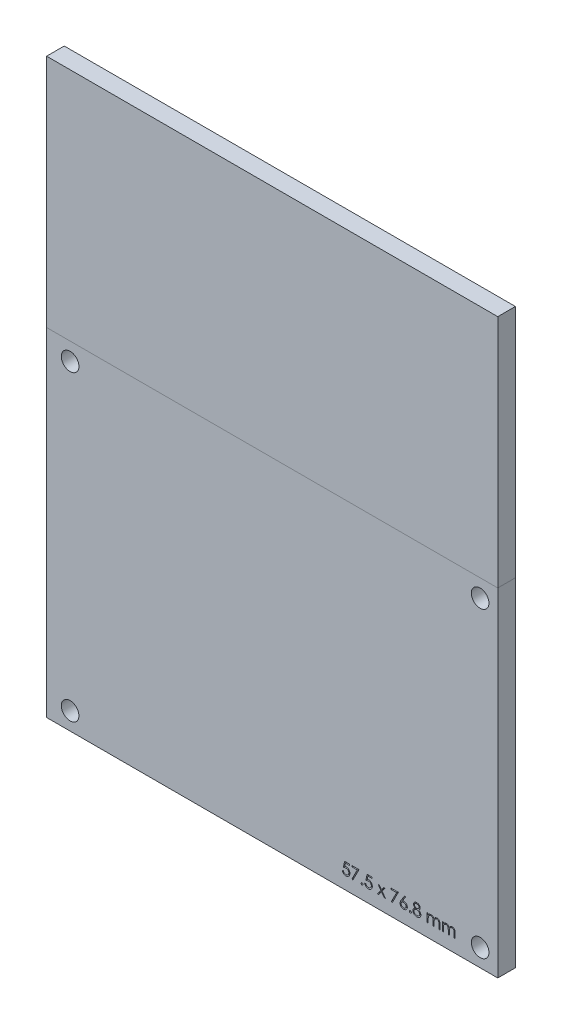
from build123d import *

# Parameters (mm, degrees)
SKETCH1_W               = 76.8
SKETCH1_H               = 57.5
BOSS_EXTRUDE1_DEPTH     = 3
CUT_EXTRUDE1_DEPTH      = 49.063733729
CUT_EXTRUDE1_DEPTH_BACK = 49.063733729
SKETCH2_R               = 1.5
CUT_EXTRUDE2_DEPTH      = 1
SKETCH5_W               = 76.8
SKETCH5_H               = 3
BOSS_EXTRUDE2_DEPTH     = 40


with BuildPart() as part:
    # Sketch1 → Boss-Extrude1 (new body)
    with BuildSketch(Plane.XY):
        Rectangle(SKETCH1_W, SKETCH1_H)
    extrude(amount=BOSS_EXTRUDE1_DEPTH)

    # Sketch2 → Cut-Extrude1 (cut, two sides: drawn at the far end of the back side and taken through both)
    with BuildSketch(Plane.XY.offset(3).offset(-CUT_EXTRUDE1_DEPTH_BACK)):
        with Locations((-34.4, 25.75)):
            Circle(SKETCH2_R)
        with Locations((-34.4, -25.75)):
            Circle(SKETCH2_R)
        with Locations((35.4, 25.75)):
            Circle(SKETCH2_R)
        with Locations((35.4, -25.75)):
            Circle(SKETCH2_R)
    extrude(amount=CUT_EXTRUDE1_DEPTH + CUT_EXTRUDE1_DEPTH_BACK, mode=Mode.SUBTRACT)

    # Sketch4 → Cut-Extrude2 (cut)
    # profile 1 of 11: a face of its own
    with BuildSketch(Plane.XY.offset(3)):
        with BuildLine():
            Line((13.150995229, -24.575900755), (13.150995229, -24.78102896))
            Line((13.150995229, -24.78102896), (12.470706767, -24.78102896))
            Line((12.470706767, -24.78102896), (12.362934332, -25.307070627))
            add(Edge.make_bspline(
                [(12.362934332, -25.307070627), (12.384109117, -25.301224757), (12.425131915, -25.289899309), (12.485680407, -25.277324583), (12.543161666, -25.26974433), (12.580461877, -25.268709295), (12.598511255, -25.268208447)],
                knots=[0, 0, 0, 0, 1.100273476, 2.13160584, 3.095893838, 4, 4, 4, 4], degree=3))
            add(Edge.make_bspline(
                [(12.598511255, -25.268208447), (12.62084482, -25.268691839), (12.66475819, -25.269642308), (12.729009017, -25.278769079), (12.790342099, -25.293134745), (12.848629167, -25.313203614), (12.903978054, -25.338866319), (12.955879517, -25.370923428), (13.00511261, -25.408371046), (13.050794093, -25.451425338), (13.092236554, -25.498809119), (13.128674263, -25.549756474), (13.159624314, -25.603772281), (13.184516174, -25.661372629), (13.204392937, -25.721920717), (13.217622648, -25.786053621), (13.226432196, -25.853166832), (13.227416417, -25.899055158), (13.227918306, -25.922455242)],
                knots=[0, 0, 0, 0, 1.052922333, 2.070308379, 3.05430497, 4.020497103, 4.973039431, 5.925935799, 6.892292201, 7.88610001, 8.88166317, 9.857072816, 10.836096531, 11.812156883, 12.81219415, 13.836441305, 14.89672472, 16, 16, 16, 16], degree=3))
            add(Edge.make_bspline(
                [(13.227918306, -25.922455242), (13.227538263, -25.938753654), (13.226783313, -25.971130218), (13.22294412, -26.019212619), (13.215552282, -26.066277095), (13.205627868, -26.11232989), (13.192746487, -26.157283817), (13.177152742, -26.201267547), (13.158069297, -26.244007322), (13.137137083, -26.285907548), (13.113567667, -26.326020981), (13.08740852, -26.363534687), (13.059771096, -26.39901142), (13.030033162, -26.432070696), (12.997918307, -26.462495277), (12.963815469, -26.490465724), (12.927996773, -26.516455056), (12.889908063, -26.53940831), (12.850398072, -26.560529999), (12.808896234, -26.577857735), (12.766347262, -26.593349465), (12.722138762, -26.605697767), (12.676370869, -26.615373512), (12.62896814, -26.621945284), (12.580179186, -26.62673182), (12.54710775, -26.627031452), (12.53040228, -26.627182806)],
                knots=[0, 0, 0, 0, 1.056347294, 2.098418968, 3.122841568, 4.141288669, 5.149314143, 6.15115421, 7.162517403, 8.180376062, 9.185164535, 10.17417709, 11.141909838, 12.097768115, 13.052685741, 14.0056014, 14.954263652, 15.917497458, 16.885230207, 17.854509472, 18.828990115, 19.81800267, 20.826176721, 21.857883937, 22.917946725, 24, 24, 24, 24], degree=3))
            add(Edge.make_bspline(
                [(12.53040228, -26.627182806), (12.510474177, -26.626788042), (12.471267988, -26.626011389), (12.413827664, -26.61788654), (12.358562175, -26.606250017), (12.305916403, -26.588743577), (12.255418538, -26.56680798), (12.207748414, -26.539084453), (12.16168797, -26.507667823), (12.119109663, -26.470593335), (12.079591884, -26.430070088), (12.044216736, -26.386094293), (12.012711835, -26.339391755), (11.985581694, -26.289735667), (11.962439968, -26.237256506), (11.944259974, -26.181757649), (11.929586629, -26.123529075), (11.92337896, -26.083441355), (11.920225998, -26.063080242)],
                knots=[0, 0, 0, 0, 1.0467383, 2.05933395, 3.04377827, 4.011590433, 4.970194871, 5.932262533, 6.905835911, 7.896367577, 8.894135286, 9.877477877, 10.858688626, 11.851381753, 12.8477658, 13.868841284, 14.917554742, 16, 16, 16, 16], degree=3))
            Line((11.920225998, -26.063080242), (12.099713178, -26.063080242))
            add(Edge.make_bspline(
                [(12.099713178, -26.063080242), (12.104129496, -26.082152501), (12.112617906, -26.118810441), (12.131249762, -26.170314064), (12.154030262, -26.216210764), (12.181118461, -26.257107668), (12.213432765, -26.292769952), (12.250306724, -26.324551131), (12.29164828, -26.353222633), (12.337587268, -26.377121357), (12.386051885, -26.397503502), (12.436776005, -26.411075899), (12.488378489, -26.420619267), (12.523280415, -26.421574558), (12.540818947, -26.422054601)],
                knots=[0, 0, 0, 0, 1.136247022, 2.183929868, 3.172523383, 4.106158343, 5.02341133, 5.958108904, 6.928429099, 7.938127109, 8.96079061, 9.975095812, 10.982467395, 12, 12, 12, 12], degree=3))
            add(Edge.make_bspline(
                [(12.540818947, -26.422054601), (12.557938058, -26.421585585), (12.591645728, -26.420662089), (12.641252235, -26.413554082), (12.689145306, -26.402606898), (12.734852367, -26.386224124), (12.779173246, -26.366312857), (12.820986829, -26.340761385), (12.861502759, -26.31135566), (12.899461693, -26.277666157), (12.934227092, -26.240540617), (12.964944876, -26.200839249), (12.990531683, -26.158486766), (13.012094031, -26.114216393), (13.028467345, -26.067542931), (13.040147906, -26.018685117), (13.047006796, -25.967522271), (13.047950328, -25.932625523), (13.048431126, -25.914843063)],
                knots=[0, 0, 0, 0, 1.027316725, 2.022795036, 3.002884548, 3.971462791, 4.93288096, 5.914575861, 6.907176829, 7.935150275, 8.956128384, 9.956726525, 10.942570165, 11.921478529, 12.907843606, 13.90538589, 14.932640048, 16, 16, 16, 16], degree=3))
            add(Edge.make_bspline(
                [(13.048431126, -25.914843063), (13.048054852, -25.898799776), (13.04731835, -25.867397325), (13.041300881, -25.821454922), (13.03083404, -25.777984612), (13.016306108, -25.736776478), (12.997860675, -25.697791654), (12.975319925, -25.660989905), (12.948260841, -25.626856286), (12.91735119, -25.595374827), (12.883489452, -25.566320613), (12.846093028, -25.541552563), (12.805944499, -25.520716039), (12.763527585, -25.502734326), (12.717833357, -25.489819614), (12.66976671, -25.480123679), (12.618808591, -25.474514901), (12.583968198, -25.473736679), (12.566059332, -25.473336652)],
                knots=[0, 0, 0, 0, 1.045622112, 2.046656509, 3.013763289, 3.955457236, 4.890082067, 5.820317437, 6.762574623, 7.722996705, 8.69280354, 9.665887285, 10.63943826, 11.638615906, 12.663482002, 13.728887084, 14.832589034, 16, 16, 16, 16], degree=3))
            add(Edge.make_bspline(
                [(12.566059332, -25.473336652), (12.550557087, -25.473668419), (12.518548883, -25.474353432), (12.469450125, -25.479397145), (12.417854855, -25.487533884), (12.363960858, -25.498726026), (12.307606282, -25.513372355), (12.248910053, -25.530923499), (12.187748757, -25.551907498), (12.146538629, -25.567754477), (12.125354203, -25.575900755)],
                knots=[0, 0, 0, 0, 0.817624296, 1.688186739, 2.600797293, 3.572016777, 4.590301741, 5.671205678, 6.80286297, 8, 8, 8, 8], degree=3))
            Line((12.125354203, -25.575900755), (12.330482408, -24.575900755))
            Line((12.330482408, -24.575900755), (13.150995229, -24.575900755))
        make_face()
    # profile 2 of 11: a face of its own
    with BuildSketch(Plane.XY.offset(3)):
        Polygon((13.561251639, -24.575900755), (14.79202087, -24.575900755), (13.740738819, -26.627182806), (13.585690742, -26.541846268), (14.488334973, -24.78102896), (13.561251639, -24.78102896), align=None)
    # profile 3 of 11: a face of its own
    with BuildSketch(Plane.XY.offset(3)):
        with BuildLine():
            add(Edge.make_bspline(
                [(15.29202087, -26.268208447), (15.303158134, -26.268870257), (15.324991438, -26.270167657), (15.356556655, -26.279068614), (15.385125031, -26.294873562), (15.410572029, -26.315938007), (15.431547158, -26.341478386), (15.447915359, -26.369818905), (15.456738779, -26.401648387), (15.458026729, -26.423608201), (15.458687537, -26.434875114)],
                knots=[0, 0, 0, 0, 1.020151414, 1.999887582, 2.974338812, 3.990962822, 5.007586832, 5.987933904, 6.967670073, 8, 8, 8, 8], degree=3))
            add(Edge.make_bspline(
                [(15.458687537, -26.434875114), (15.458004336, -26.445871302), (15.456657075, -26.467555625), (15.447935585, -26.499145032), (15.431422413, -26.527503263), (15.410716703, -26.553390199), (15.385118741, -26.574499268), (15.356489114, -26.590169751), (15.325065538, -26.599708025), (15.303170496, -26.600923052), (15.29202087, -26.601541781)],
                knots=[0, 0, 0, 0, 1.009421747, 1.99056486, 2.972319754, 3.999869655, 5.017953583, 5.993804169, 6.978383603, 8, 8, 8, 8], degree=3))
            add(Edge.make_bspline(
                [(15.29202087, -26.601541781), (15.28086321, -26.600945439), (15.259080534, -26.599781225), (15.227774251, -26.589973907), (15.198970269, -26.574646216), (15.173377291, -26.553350839), (15.152498165, -26.527636471), (15.136712232, -26.49894973), (15.127232146, -26.467646052), (15.125985362, -26.445889113), (15.125354203, -26.434875114)],
                knots=[0, 0, 0, 0, 1.022052826, 1.995314843, 2.982371812, 4.00089066, 5.028879526, 6.005146991, 6.990147033, 8, 8, 8, 8], degree=3))
            add(Edge.make_bspline(
                [(15.125354203, -26.434875114), (15.125961117, -26.423589754), (15.127146042, -26.401556474), (15.136732134, -26.370014127), (15.152375683, -26.341346448), (15.173521623, -26.315976973), (15.198964078, -26.294727086), (15.227704767, -26.27926149), (15.259155933, -26.27009554), (15.280875897, -26.268848388), (15.29202087, -26.268208447)],
                knots=[0, 0, 0, 0, 1.032775665, 2.016367738, 2.991239715, 4.008302682, 5.025365648, 6.011011707, 6.979408107, 8, 8, 8, 8], degree=3))
        make_face()
    # profile 4 of 11: a face of its own
    with BuildSketch(Plane.XY.offset(3)):
        with BuildLine():
            Line((16.971508049, -24.575900755), (16.971508049, -24.78102896))
            Line((16.971508049, -24.78102896), (16.291219588, -24.78102896))
            Line((16.291219588, -24.78102896), (16.183447152, -25.307070627))
            add(Edge.make_bspline(
                [(16.183447152, -25.307070627), (16.204621937, -25.301224757), (16.245644735, -25.289899309), (16.306193227, -25.277324583), (16.363674486, -25.26974433), (16.400974698, -25.268709295), (16.419024075, -25.268208447)],
                knots=[0, 0, 0, 0, 1.100273476, 2.13160584, 3.095893838, 4, 4, 4, 4], degree=3))
            add(Edge.make_bspline(
                [(16.419024075, -25.268208447), (16.441357641, -25.268691839), (16.485271011, -25.269642308), (16.549521837, -25.278769079), (16.610854919, -25.293134745), (16.669141988, -25.313203614), (16.724490874, -25.338866319), (16.776392338, -25.370923428), (16.825625431, -25.408371046), (16.871306913, -25.451425338), (16.912749375, -25.498809119), (16.949187083, -25.549756474), (16.980137135, -25.603772281), (17.005028995, -25.661372629), (17.024905757, -25.721920717), (17.038135469, -25.786053621), (17.046945017, -25.853166832), (17.047929237, -25.899055158), (17.048431126, -25.922455242)],
                knots=[0, 0, 0, 0, 1.052922333, 2.070308379, 3.05430497, 4.020497103, 4.973039431, 5.925935799, 6.892292201, 7.88610001, 8.88166317, 9.857072816, 10.836096531, 11.812156883, 12.81219415, 13.836441305, 14.89672472, 16, 16, 16, 16], degree=3))
            add(Edge.make_bspline(
                [(17.048431126, -25.922455242), (17.048051083, -25.938753654), (17.047296133, -25.971130218), (17.04345694, -26.019212619), (17.036065103, -26.066277095), (17.026140689, -26.11232989), (17.013259307, -26.157283817), (16.997665562, -26.201267547), (16.978582118, -26.244007322), (16.957649903, -26.285907548), (16.934080487, -26.326020981), (16.90792134, -26.363534687), (16.880283917, -26.39901142), (16.850545982, -26.432070696), (16.818431128, -26.462495277), (16.78432829, -26.490465724), (16.748509593, -26.516455056), (16.710420883, -26.53940831), (16.670910893, -26.560529999), (16.629409055, -26.577857735), (16.586860083, -26.593349465), (16.542651582, -26.605697767), (16.49688369, -26.615373512), (16.449480961, -26.621945284), (16.400692006, -26.62673182), (16.367620571, -26.627031452), (16.350915101, -26.627182806)],
                knots=[0, 0, 0, 0, 1.056347294, 2.098418968, 3.122841568, 4.141288669, 5.149314143, 6.15115421, 7.162517403, 8.180376062, 9.185164535, 10.17417709, 11.141909838, 12.097768115, 13.052685741, 14.0056014, 14.954263652, 15.917497458, 16.885230207, 17.854509472, 18.828990115, 19.81800267, 20.826176721, 21.857883937, 22.917946725, 24, 24, 24, 24], degree=3))
            add(Edge.make_bspline(
                [(16.350915101, -26.627182806), (16.330986998, -26.626788042), (16.291780809, -26.626011389), (16.234340485, -26.61788654), (16.179074996, -26.606250017), (16.126429223, -26.588743577), (16.075931358, -26.56680798), (16.028261234, -26.539084453), (15.982200791, -26.507667823), (15.939622484, -26.470593335), (15.900104705, -26.430070088), (15.864729557, -26.386094293), (15.833224656, -26.339391755), (15.806094515, -26.289735667), (15.782952788, -26.237256506), (15.764772795, -26.181757649), (15.750099449, -26.123529075), (15.74389178, -26.083441355), (15.740738819, -26.063080242)],
                knots=[0, 0, 0, 0, 1.0467383, 2.05933395, 3.04377827, 4.011590433, 4.970194871, 5.932262533, 6.905835911, 7.896367577, 8.894135286, 9.877477877, 10.858688626, 11.851381753, 12.8477658, 13.868841284, 14.917554742, 16, 16, 16, 16], degree=3))
            Line((15.740738819, -26.063080242), (15.920225998, -26.063080242))
            add(Edge.make_bspline(
                [(15.920225998, -26.063080242), (15.924642317, -26.082152501), (15.933130726, -26.118810441), (15.951762583, -26.170314064), (15.974543083, -26.216210764), (16.001631282, -26.257107668), (16.033945585, -26.292769952), (16.070819544, -26.324551131), (16.112161101, -26.353222633), (16.158100089, -26.377121357), (16.206564706, -26.397503502), (16.257288826, -26.411075899), (16.308891309, -26.420619267), (16.343793235, -26.421574558), (16.361331767, -26.422054601)],
                knots=[0, 0, 0, 0, 1.136247022, 2.183929868, 3.172523383, 4.106158343, 5.02341133, 5.958108904, 6.928429099, 7.938127109, 8.96079061, 9.975095812, 10.982467395, 12, 12, 12, 12], degree=3))
            add(Edge.make_bspline(
                [(16.361331767, -26.422054601), (16.378450879, -26.421585585), (16.412158548, -26.420662089), (16.461765055, -26.413554082), (16.509658126, -26.402606898), (16.555365187, -26.386224124), (16.599686067, -26.366312857), (16.64149965, -26.340761385), (16.68201558, -26.31135566), (16.719974513, -26.277666157), (16.754739913, -26.240540617), (16.785457696, -26.200839249), (16.811044504, -26.158486766), (16.832606852, -26.114216393), (16.848980165, -26.067542931), (16.860660726, -26.018685117), (16.867519617, -25.967522271), (16.868463148, -25.932625523), (16.868943947, -25.914843063)],
                knots=[0, 0, 0, 0, 1.027316725, 2.022795036, 3.002884548, 3.971462791, 4.93288096, 5.914575861, 6.907176829, 7.935150275, 8.956128384, 9.956726525, 10.942570165, 11.921478529, 12.907843606, 13.90538589, 14.932640048, 16, 16, 16, 16], degree=3))
            add(Edge.make_bspline(
                [(16.868943947, -25.914843063), (16.868567673, -25.898799776), (16.86783117, -25.867397325), (16.861813701, -25.821454922), (16.85134686, -25.777984612), (16.836818929, -25.736776478), (16.818373496, -25.697791654), (16.795832746, -25.660989905), (16.768773661, -25.626856286), (16.737864011, -25.595374827), (16.704002273, -25.566320613), (16.666605849, -25.541552563), (16.626457319, -25.520716039), (16.584040405, -25.502734326), (16.538346177, -25.489819614), (16.49027953, -25.480123679), (16.439321411, -25.474514901), (16.404481018, -25.473736679), (16.386572152, -25.473336652)],
                knots=[0, 0, 0, 0, 1.045622112, 2.046656509, 3.013763289, 3.955457236, 4.890082067, 5.820317437, 6.762574623, 7.722996705, 8.69280354, 9.665887285, 10.63943826, 11.638615906, 12.663482002, 13.728887084, 14.832589034, 16, 16, 16, 16], degree=3))
            add(Edge.make_bspline(
                [(16.386572152, -25.473336652), (16.371069907, -25.473668419), (16.339061704, -25.474353432), (16.289962946, -25.479397145), (16.238367676, -25.487533884), (16.184473678, -25.498726026), (16.128119102, -25.513372355), (16.069422873, -25.530923499), (16.008261578, -25.551907498), (15.96705145, -25.567754477), (15.945867024, -25.575900755)],
                knots=[0, 0, 0, 0, 0.817624296, 1.688186739, 2.600797293, 3.572016777, 4.590301741, 5.671205678, 6.80286297, 8, 8, 8, 8], degree=3))
            Line((15.945867024, -25.575900755), (16.150995229, -24.575900755))
            Line((16.150995229, -24.575900755), (16.971508049, -24.575900755))
        make_face()
    # profile 5 of 11: a face of its own
    with BuildSketch(Plane.XY.offset(3)):
        Polygon((18.022790101, -25.114362293), (18.236331767, -25.114362293), (18.612533691, -25.641605883), (18.988735614, -25.114362293), (19.20227728, -25.114362293), (18.719504844, -25.791044986), (19.279200357, -26.575900755), (19.065658691, -26.575900755), (18.612533691, -25.940884729), (18.159408691, -26.575900755), (17.945867024, -26.575900755), (18.505963178, -25.791044986), align=None)
    # profile 6 of 11: a face of its own
    with BuildSketch(Plane.XY.offset(3)):
        Polygon((20.253559332, -24.575900755), (21.484328562, -24.575900755), (20.433046511, -26.627182806), (20.277998434, -26.541846268), (21.180642665, -24.78102896), (20.253559332, -24.78102896), align=None)
    # profile 7 of 11: a face of its own
    with BuildSketch(Plane.XY.offset(3)):
        with BuildLine():
            Line((22.586892665, -24.524618704), (22.725113819, -24.633192422))
            Line((22.725113819, -24.633192422), (22.196668306, -25.44128537))
            add(Edge.make_bspline(
                [(22.196668306, -25.44128537), (22.231851321, -25.43567745), (22.300479771, -25.424738567), (22.369945999, -25.422934027), (22.403799716, -25.422054601)],
                knots=[0, 0, 0, 0, 1.025318673, 2, 2, 2, 2], degree=3))
            add(Edge.make_bspline(
                [(22.403799716, -25.422054601), (22.424126857, -25.422600951), (22.464140229, -25.423676424), (22.522886973, -25.43195291), (22.579337793, -25.444995831), (22.633258715, -25.464008548), (22.684843276, -25.488295608), (22.734387502, -25.517403534), (22.780960079, -25.552835351), (22.825160753, -25.592415326), (22.865290523, -25.636253603), (22.900819698, -25.682768652), (22.930663579, -25.731912013), (22.954877248, -25.783658794), (22.973680036, -25.837929228), (22.987387262, -25.894653879), (22.995489886, -25.953871862), (22.996590166, -25.994145105), (22.997149075, -26.014602678)],
                knots=[0, 0, 0, 0, 1.04369286, 2.054478336, 3.041073146, 4.015093852, 4.984733326, 5.965804835, 6.960378782, 7.985147595, 9.009457201, 10.008161701, 10.986880575, 11.956520048, 12.937015923, 13.931873656, 14.949455224, 16, 16, 16, 16], degree=3))
            add(Edge.make_bspline(
                [(22.997149075, -26.014602678), (22.996335872, -26.04259108), (22.994735682, -26.097665632), (22.978790655, -26.177880893), (22.954013716, -26.254299473), (22.918597985, -26.325701286), (22.874608052, -26.391988468), (22.820963713, -26.45072302), (22.759567434, -26.503105898), (22.690146407, -26.546909681), (22.615436141, -26.582682853), (22.536949286, -26.608377277), (22.455448059, -26.624196402), (22.40013114, -26.626179604), (22.372149075, -26.627182806)],
                knots=[0, 0, 0, 0, 1.031375318, 2.029502543, 3.004789286, 3.987476834, 4.960371455, 5.9300674, 6.912260825, 7.929083631, 8.949397511, 9.960523116, 10.96833055, 12, 12, 12, 12], degree=3))
            add(Edge.make_bspline(
                [(22.372149075, -26.627182806), (22.345236675, -26.626309546), (22.291927922, -26.62457977), (22.213509182, -26.609170663), (22.138158886, -26.584195175), (22.066404954, -26.549787016), (21.999936033, -26.506325369), (21.940469955, -26.454004066), (21.888303227, -26.393941515), (21.844889157, -26.326147031), (21.810455596, -26.253295626), (21.784632782, -26.177331537), (21.769549214, -26.098531547), (21.767441468, -26.045113754), (21.766379844, -26.018208447)],
                knots=[0, 0, 0, 0, 1.012016664, 2.004627821, 2.994792927, 3.992885782, 4.990978636, 5.973936114, 6.964471063, 7.975201453, 8.993600317, 9.990122807, 10.98767138, 12, 12, 12, 12], degree=3))
            add(Edge.make_bspline(
                [(21.766379844, -26.018208447), (21.767054956, -25.997611543), (21.768433404, -25.955556599), (21.778058199, -25.891862868), (21.793523796, -25.826690822), (21.810843937, -25.771402711), (21.829144285, -25.726110413), (21.844374308, -25.689594132), (21.863330877, -25.652016376), (21.883544238, -25.612088584), (21.906833877, -25.570839766), (21.932157105, -25.527580526), (21.960214049, -25.482998853), (21.979882713, -25.452745027), (21.989937537, -25.43727896)],
                knots=[0, 0, 0, 0, 1.173818275, 2.396712641, 3.66331629, 4.989737886, 5.693666774, 6.447286557, 7.243889047, 8.091586357, 8.998013824, 9.943181721, 10.948533338, 12, 12, 12, 12], degree=3))
            Line((21.989937537, -25.43727896), (22.586892665, -24.524618704))
        make_face()
        with BuildLine():
            add(Edge.make_bspline(
                [(22.36613946, -25.627182806), (22.350903891, -25.627627403), (22.3211444, -25.628495829), (22.27748302, -25.63353883), (22.236161162, -25.643035439), (22.196631372, -25.655130485), (22.159632684, -25.671760805), (22.124896204, -25.691961833), (22.092287603, -25.715745364), (22.062148431, -25.742774456), (22.034822909, -25.772367617), (22.011290834, -25.804064487), (21.99099232, -25.837101175), (21.974488423, -25.871753713), (21.961636952, -25.908008856), (21.952340808, -25.945699855), (21.947167236, -25.985079459), (21.946306532, -26.011783746), (21.945867024, -26.025419986)],
                knots=[0, 0, 0, 0, 1.129588631, 2.206414736, 3.251139165, 4.268635594, 5.265702196, 6.250456724, 7.242448911, 8.251968645, 9.246821453, 10.222880186, 11.173611482, 12.116736599, 13.062300278, 14.020270554, 14.989073742, 16, 16, 16, 16], degree=3))
            add(Edge.make_bspline(
                [(21.945867024, -26.025419986), (21.946224945, -26.03893426), (21.946926774, -26.06543374), (21.953299528, -26.1044847), (21.963033861, -26.142064647), (21.977514087, -26.177979847), (21.994786595, -26.212777743), (22.017589637, -26.245197906), (22.042856372, -26.277209374), (22.07305862, -26.306353072), (22.10547197, -26.333471143), (22.140101229, -26.357174145), (22.176192634, -26.377451959), (22.214233447, -26.393344014), (22.253683952, -26.406386464), (22.29487284, -26.415564452), (22.337828757, -26.420753324), (22.366927008, -26.421615149), (22.38176446, -26.422054601)],
                knots=[0, 0, 0, 0, 0.989467248, 1.94019797, 2.891935182, 3.827694429, 4.772920941, 5.730924762, 6.725747692, 7.756678648, 8.79901574, 9.819492441, 10.826891316, 11.826466727, 12.835195252, 13.867842842, 14.912794438, 16, 16, 16, 16], degree=3))
            add(Edge.make_bspline(
                [(22.38176446, -26.422054601), (22.396601887, -26.421615115), (22.42570009, -26.420753222), (22.468656353, -26.41556484), (22.509843964, -26.406385041), (22.549299112, -26.393349172), (22.587322786, -26.377432824), (22.623382627, -26.357300299), (22.657684395, -26.333325374), (22.690119023, -26.306399415), (22.72019556, -26.2770435), (22.74606829, -26.245483658), (22.768172995, -26.212515718), (22.786135388, -26.178116924), (22.800456126, -26.142042931), (22.810239821, -26.104490517), (22.816599415, -26.065432217), (22.817303053, -26.038933746), (22.817661896, -26.025419986)],
                knots=[0, 0, 0, 0, 1.087397944, 2.132534446, 3.165364764, 4.174271784, 5.174024072, 6.181601208, 7.194203697, 8.236725232, 9.267838612, 10.269026844, 11.221737037, 12.171628256, 13.107553087, 14.05945871, 15.010357665, 16, 16, 16, 16], degree=3))
            add(Edge.make_bspline(
                [(22.817661896, -26.025419986), (22.817347443, -26.011765957), (22.816730273, -25.984967538), (22.809749731, -25.945717471), (22.800068375, -25.907817353), (22.7854495, -25.871505382), (22.766457189, -25.836924852), (22.743323813, -25.80390108), (22.716562345, -25.772180882), (22.685649465, -25.74271642), (22.651997903, -25.715775232), (22.616217568, -25.691992629), (22.57878444, -25.671921213), (22.539736473, -25.655174298), (22.498626254, -25.643088884), (22.456117489, -25.633572745), (22.411666493, -25.628508735), (22.381508431, -25.627630412), (22.36613946, -25.627182806)],
                knots=[0, 0, 0, 0, 0.978206639, 1.919901502, 2.851605144, 3.780102724, 4.718870031, 5.675451981, 6.667674623, 7.690630536, 8.733308323, 9.756129687, 10.767539656, 11.776269907, 12.797430371, 13.836405707, 14.897401972, 16, 16, 16, 16], degree=3))
        make_face(mode=Mode.SUBTRACT)
    # profile 8 of 11: a face of its own
    with BuildSketch(Plane.XY.offset(3)):
        with BuildLine():
            add(Edge.make_bspline(
                [(23.522790101, -26.268208447), (23.533927365, -26.268870257), (23.555760669, -26.270167657), (23.587325885, -26.279068614), (23.615894262, -26.294873562), (23.641341259, -26.315938007), (23.662316389, -26.341478386), (23.67868459, -26.369818905), (23.68750801, -26.401648387), (23.68879596, -26.423608201), (23.689456767, -26.434875114)],
                knots=[0, 0, 0, 0, 1.020151414, 1.999887582, 2.974338812, 3.990962822, 5.007586832, 5.987933904, 6.967670073, 8, 8, 8, 8], degree=3))
            add(Edge.make_bspline(
                [(23.689456767, -26.434875114), (23.688773567, -26.445871302), (23.687426306, -26.467555625), (23.678704815, -26.499145032), (23.662191644, -26.527503263), (23.641485934, -26.553390199), (23.615887972, -26.574499268), (23.587258345, -26.590169751), (23.555834769, -26.599708025), (23.533939727, -26.600923052), (23.522790101, -26.601541781)],
                knots=[0, 0, 0, 0, 1.009421747, 1.99056486, 2.972319754, 3.999869655, 5.017953583, 5.993804169, 6.978383603, 8, 8, 8, 8], degree=3))
            add(Edge.make_bspline(
                [(23.522790101, -26.601541781), (23.51163244, -26.600945439), (23.489849765, -26.599781225), (23.458543482, -26.589973907), (23.4297395, -26.574646216), (23.404146522, -26.553350839), (23.383267395, -26.527636471), (23.367481462, -26.49894973), (23.358001377, -26.467646052), (23.356754593, -26.445889113), (23.356123434, -26.434875114)],
                knots=[0, 0, 0, 0, 1.022052826, 1.995314843, 2.982371812, 4.00089066, 5.028879526, 6.005146991, 6.990147033, 8, 8, 8, 8], degree=3))
            add(Edge.make_bspline(
                [(23.356123434, -26.434875114), (23.356730348, -26.423589754), (23.357915273, -26.401556474), (23.367501364, -26.370014127), (23.383144914, -26.341346448), (23.404290854, -26.315976973), (23.429733309, -26.294727086), (23.458473997, -26.27926149), (23.489925163, -26.27009554), (23.511645128, -26.268848388), (23.522790101, -26.268208447)],
                knots=[0, 0, 0, 0, 1.032775665, 2.016367738, 2.991239715, 4.008302682, 5.025365648, 6.011011707, 6.979408107, 8, 8, 8, 8], degree=3))
        make_face()
    # profile 9 of 11: a face of its own
    with BuildSketch(Plane.XY.offset(3)):
        with BuildLine():
            add(Edge.make_bspline(
                [(24.918222793, -25.461718063), (24.934593391, -25.470254038), (24.966521526, -25.486902039), (25.011994216, -25.513708226), (25.053551359, -25.541960206), (25.092345966, -25.570323555), (25.127696452, -25.599884498), (25.159207545, -25.630760588), (25.187657614, -25.662181128), (25.212472919, -25.694678179), (25.234299683, -25.728165407), (25.25316376, -25.762730706), (25.269287876, -25.798298325), (25.282066698, -25.835256514), (25.292593436, -25.873062378), (25.299836639, -25.912204082), (25.303732021, -25.952423705), (25.304468486, -25.979605592), (25.304841383, -25.993368704)],
                knots=[0, 0, 0, 0, 1.272397273, 2.481599622, 3.635517121, 4.734568067, 5.792894095, 6.808321871, 7.773003508, 8.711915296, 9.623354172, 10.525449501, 11.423591555, 12.311487226, 13.218079475, 14.126165749, 15.051214107, 16, 16, 16, 16], degree=3))
            add(Edge.make_bspline(
                [(25.304841383, -25.993368704), (25.304400571, -26.012624551), (25.303528039, -26.050739098), (25.295928048, -26.106994019), (25.284549204, -26.161629323), (25.267932339, -26.214633032), (25.24638183, -26.265712673), (25.219823638, -26.314911973), (25.189760093, -26.363037292), (25.165615956, -26.392648379), (25.153399075, -26.407631524)],
                knots=[0, 0, 0, 0, 1.025265484, 2.029385089, 3.018602448, 3.995076438, 4.983346944, 5.966715145, 6.97116228, 8, 8, 8, 8], degree=3))
            add(Edge.make_bspline(
                [(25.153399075, -26.407631524), (25.137492518, -26.425113681), (25.105875967, -26.459861962), (25.051714294, -26.504976711), (24.992273217, -26.54289065), (24.927782741, -26.573788876), (24.858415255, -26.597837938), (24.784185538, -26.615119377), (24.704948879, -26.625017908), (24.65048861, -26.626448759), (24.622549716, -26.627182806)],
                knots=[0, 0, 0, 0, 0.954267603, 1.896743057, 2.838368354, 3.796610408, 4.779680527, 5.799409237, 6.871065594, 8, 8, 8, 8], degree=3))
            add(Edge.make_bspline(
                [(24.622549716, -26.627182806), (24.595684923, -26.626524247), (24.543408763, -26.625242759), (24.467318548, -26.616560227), (24.396391079, -26.601344303), (24.330213954, -26.580518812), (24.26918613, -26.553427253), (24.2134815, -26.519708162), (24.162296373, -26.480718766), (24.117184103, -26.435339293), (24.077133563, -26.386734795), (24.041951819, -26.336591018), (24.012709488, -26.284903385), (23.987951148, -26.232442604), (23.968997992, -26.178473373), (23.955871015, -26.123273365), (23.947534264, -26.066938998), (23.946425044, -26.02892091), (23.945867024, -26.009794986)],
                knots=[0, 0, 0, 0, 1.256902934, 2.445805442, 3.576955095, 4.645999104, 5.686449165, 6.692658513, 7.68621702, 8.689161843, 9.678783111, 10.630372946, 11.551080876, 12.453998257, 13.34127905, 14.221779781, 15.105423033, 16, 16, 16, 16], degree=3))
            add(Edge.make_bspline(
                [(23.945867024, -26.009794986), (23.946197242, -25.995761162), (23.946849868, -25.968025372), (23.951366925, -25.927048613), (23.958628902, -25.887165108), (23.968491449, -25.84822754), (23.98185775, -25.810519384), (23.997996112, -25.77386197), (24.01681437, -25.738213914), (24.038575036, -25.703380268), (24.063890478, -25.669849118), (24.092555421, -25.637051407), (24.125142775, -25.605496054), (24.161290008, -25.574797525), (24.200584031, -25.544411255), (24.244045477, -25.51597941), (24.290522201, -25.487489144), (24.323553862, -25.470455815), (24.340498434, -25.461718063)],
                knots=[0, 0, 0, 0, 0.941657376, 1.861047343, 2.762797495, 3.66048619, 4.553285746, 5.444104102, 6.34607688, 7.256116206, 8.197091036, 9.162375105, 10.176350973, 11.237807142, 12.343728897, 13.50695164, 14.721116704, 16, 16, 16, 16], degree=3))
            add(Edge.make_bspline(
                [(24.340498434, -25.461718063), (24.317303363, -25.449069624), (24.272391213, -25.424578705), (24.212922961, -25.37958053), (24.161842604, -25.330844636), (24.120554194, -25.277341896), (24.088055778, -25.220743682), (24.065759433, -25.161404109), (24.050675728, -25.100423473), (24.049181541, -25.058762789), (24.048431126, -25.037839858)],
                knots=[0, 0, 0, 0, 1.166880483, 2.259407225, 3.286803203, 4.280235371, 5.237608625, 6.161067461, 7.076446754, 8, 8, 8, 8], degree=3))
            add(Edge.make_bspline(
                [(24.048431126, -25.037839858), (24.049365654, -25.016526967), (24.051244219, -24.97368434), (24.066434688, -24.909909413), (24.091189011, -24.847271376), (24.124858153, -24.786073825), (24.166793705, -24.728387988), (24.217106017, -24.676650305), (24.274593615, -24.631329458), (24.338969539, -24.59328593), (24.408247388, -24.56232384), (24.481342087, -24.540964741), (24.556980083, -24.527001246), (24.608464494, -24.5254203), (24.634568947, -24.524618704)],
                knots=[0, 0, 0, 0, 0.888701115, 1.786444228, 2.72001202, 3.692817113, 4.693886446, 5.687152267, 6.695133018, 7.739871481, 8.800368666, 9.853104506, 10.91144658, 12, 12, 12, 12], degree=3))
            add(Edge.make_bspline(
                [(24.634568947, -24.524618704), (24.659999698, -24.525445186), (24.710146243, -24.527074913), (24.783857459, -24.540667415), (24.85438596, -24.563369998), (24.921488531, -24.594168411), (24.983963884, -24.632103806), (25.039165203, -24.678047163), (25.087926679, -24.72955662), (25.128260618, -24.787224965), (25.161496555, -24.848187361), (25.184639927, -24.911971659), (25.199469627, -24.977199693), (25.20134012, -25.021335695), (25.20227728, -25.043448832)],
                knots=[0, 0, 0, 0, 1.072916533, 2.115669174, 3.151510826, 4.193348718, 5.225979165, 6.227137561, 7.216255879, 8.211077061, 9.189680878, 10.138522389, 11.067357538, 12, 12, 12, 12], degree=3))
            add(Edge.make_bspline(
                [(25.20227728, -25.043448832), (25.201457531, -25.065149783), (25.199847591, -25.107769217), (25.186304768, -25.169898657), (25.163497161, -25.228082679), (25.132357639, -25.282981509), (25.091771646, -25.333599508), (25.042280942, -25.380580348), (24.984280097, -25.424309964), (24.940702448, -25.448987886), (24.918222793, -25.461718063)],
                knots=[0, 0, 0, 0, 0.975232327, 1.915300861, 2.843280834, 3.77672583, 4.742871857, 5.749627742, 6.839139064, 8, 8, 8, 8], degree=3))
        make_face()
        with BuildLine():
            add(Edge.make_bspline(
                [(24.624552921, -24.729746909), (24.610523889, -24.730119161), (24.583076969, -24.730847448), (24.542832014, -24.734652383), (24.50456209, -24.742054221), (24.467867346, -24.751904914), (24.433250882, -24.765212335), (24.400242565, -24.780866627), (24.369404171, -24.799898664), (24.340363427, -24.82124792), (24.314220127, -24.84472958), (24.291017526, -24.869194563), (24.271744318, -24.895123358), (24.25537797, -24.921870992), (24.243502817, -24.950231322), (24.234608929, -24.979334851), (24.228596705, -25.009549356), (24.228146196, -25.030198791), (24.227918306, -25.040644345)],
                knots=[0, 0, 0, 0, 1.203892937, 2.355340988, 3.463153438, 4.544400666, 5.610487187, 6.640501085, 7.674077295, 8.714426146, 9.728707835, 10.68524104, 11.601827946, 12.495867327, 13.368432065, 14.231010473, 15.105153427, 16, 16, 16, 16], degree=3))
            add(Edge.make_bspline(
                [(24.227918306, -25.040644345), (24.228311087, -25.05109035), (24.229087279, -25.071733158), (24.235090209, -25.10221651), (24.244036983, -25.132171731), (24.258123076, -25.160886537), (24.275018137, -25.189357028), (24.29587041, -25.216871648), (24.320721283, -25.243526154), (24.348736963, -25.269093835), (24.379257842, -25.293035985), (24.411591581, -25.31382066), (24.445332376, -25.331211581), (24.480133558, -25.345685526), (24.516349814, -25.356936919), (24.553759227, -25.364919003), (24.592368086, -25.369880144), (24.618528417, -25.370472727), (24.63176446, -25.37077255)],
                knots=[0, 0, 0, 0, 0.873023192, 1.725219244, 2.590779336, 3.480155217, 4.391973325, 5.357036234, 6.360879153, 7.436073238, 8.526419356, 9.601555421, 10.645666583, 11.697338044, 12.750135903, 13.812665442, 14.89329948, 16, 16, 16, 16], degree=3))
            add(Edge.make_bspline(
                [(24.63176446, -25.37077255), (24.648764519, -25.370273769), (24.682596729, -25.369281133), (24.732470633, -25.36005189), (24.780963573, -25.345534223), (24.827557232, -25.325671385), (24.871045567, -25.30074118), (24.90981132, -25.270893741), (24.94352383, -25.236818257), (24.97183275, -25.199045208), (24.993781234, -25.1588443), (25.010867981, -25.118501276), (25.020845819, -25.077585715), (25.022147285, -25.050176021), (25.022790101, -25.036637935)],
                knots=[0, 0, 0, 0, 1.076279235, 2.141928126, 3.20205304, 4.278698113, 5.344010996, 6.36967002, 7.368914609, 8.37248503, 9.349703398, 10.264243087, 11.142681841, 12, 12, 12, 12], degree=3))
            add(Edge.make_bspline(
                [(25.022790101, -25.036637935), (25.022486159, -25.0271362), (25.021882879, -25.008276618), (25.016911418, -24.980426124), (25.008696657, -24.953209219), (24.997574897, -24.926401064), (24.982940728, -24.900377789), (24.965589764, -24.87473031), (24.944512906, -24.850035587), (24.920857801, -24.825718131), (24.894031853, -24.803212975), (24.864086761, -24.783421712), (24.831176046, -24.766614651), (24.795298932, -24.752963934), (24.756587547, -24.742711163), (24.71522019, -24.73503325), (24.670851935, -24.730705757), (24.640320648, -24.730073457), (24.624552921, -24.729746909)],
                knots=[0, 0, 0, 0, 0.814439003, 1.616544685, 2.417341072, 3.248991801, 4.09997495, 4.973547432, 5.9003056, 6.880240646, 7.880314356, 8.896779544, 9.951930927, 11.043077905, 12.18215768, 13.381699519, 14.647792085, 16, 16, 16, 16], degree=3))
        make_face(mode=Mode.SUBTRACT)
        with BuildLine():
            add(Edge.make_bspline(
                [(24.636171511, -25.575900755), (24.618385348, -25.576217122), (24.583493236, -25.576837755), (24.532374991, -25.583746041), (24.483316039, -25.593362837), (24.43648179, -25.607951888), (24.39189202, -25.626921311), (24.349305344, -25.649741048), (24.309047556, -25.676715587), (24.27167457, -25.707502224), (24.237546953, -25.740679055), (24.207605067, -25.775800275), (24.182177913, -25.812213151), (24.161701769, -25.850380139), (24.144895065, -25.88949306), (24.133858564, -25.930525971), (24.1267833, -25.972690036), (24.125833225, -26.00135295), (24.125354203, -26.015804601)],
                knots=[0, 0, 0, 0, 1.140299081, 2.23698856, 3.303958914, 4.344563908, 5.37730929, 6.408454204, 7.439741482, 8.480804886, 9.510774543, 10.48932336, 11.43758569, 12.353841022, 13.263987381, 14.161954604, 15.073269652, 16, 16, 16, 16], degree=3))
            add(Edge.make_bspline(
                [(24.125354203, -26.015804601), (24.126133208, -26.033765119), (24.127678736, -26.069398367), (24.139939673, -26.122062979), (24.159617121, -26.173046439), (24.187060102, -26.221933269), (24.221041572, -26.267619044), (24.262828125, -26.307441201), (24.30982289, -26.342824903), (24.363615949, -26.371442351), (24.422375072, -26.394296554), (24.486084632, -26.410042818), (24.5538303, -26.420466504), (24.60060721, -26.421516893), (24.624552921, -26.422054601)],
                knots=[0, 0, 0, 0, 0.898778495, 1.783155532, 2.693654817, 3.627872908, 4.583023416, 5.533784346, 6.509005473, 7.520592997, 8.575161974, 9.658835044, 10.801527049, 12, 12, 12, 12], degree=3))
            add(Edge.make_bspline(
                [(24.624552921, -26.422054601), (24.643267417, -26.421695282), (24.679729257, -26.420995213), (24.732921227, -26.414815617), (24.783118112, -26.405015831), (24.830222569, -26.390762376), (24.874761906, -26.37336239), (24.915980965, -26.350978343), (24.954940123, -26.325519873), (24.989719622, -26.295315212), (25.021395741, -26.263041215), (25.049014766, -26.228875476), (25.072990509, -26.193746543), (25.091808198, -26.156860552), (25.106851772, -26.118925172), (25.117665232, -26.079590594), (25.124337355, -26.038736175), (25.125012152, -26.011022421), (25.125354203, -25.996974473)],
                knots=[0, 0, 0, 0, 1.224942928, 2.386581632, 3.501229538, 4.569074225, 5.605009692, 6.626002462, 7.634866581, 8.645888296, 9.63523824, 10.59253846, 11.518950513, 12.414518923, 13.29783783, 14.186679152, 15.080837789, 16, 16, 16, 16], degree=3))
            add(Edge.make_bspline(
                [(25.125354203, -25.996974473), (25.124836576, -25.983330278), (25.123815904, -25.95642631), (25.117337795, -25.916559723), (25.105957294, -25.878043829), (25.090341638, -25.840415255), (25.069552517, -25.804436426), (25.045069734, -25.769170042), (25.015530237, -25.735594931), (24.982151611, -25.703450305), (24.945775062, -25.673727026), (24.907108122, -25.647433062), (24.86644843, -25.625288995), (24.823882023, -25.607279569), (24.77950342, -25.593115301), (24.733345261, -25.583220446), (24.685353504, -25.576992102), (24.65275072, -25.576268647), (24.636171511, -25.575900755)],
                knots=[0, 0, 0, 0, 0.917430815, 1.809013306, 2.70690318, 3.612392954, 4.541220862, 5.495268465, 6.494511384, 7.542276156, 8.608045339, 9.649016899, 10.681629292, 11.715607085, 12.752076957, 13.808767841, 14.885711793, 16, 16, 16, 16], degree=3))
        make_face(mode=Mode.SUBTRACT)
    # profile 10 of 11: a face of its own
    with BuildSketch(Plane.XY.offset(3)):
        with BuildLine():
            Line((26.38176446, -25.114362293), (26.561251639, -25.114362293))
            Line((26.561251639, -25.114362293), (26.561251639, -25.368368704))
            add(Edge.make_bspline(
                [(26.561251639, -25.368368704), (26.577413896, -25.346147217), (26.60838233, -25.303568718), (26.659162703, -25.247459984), (26.70989191, -25.199843896), (26.746425271, -25.174847969), (26.763975998, -25.162839858)],
                knots=[0, 0, 0, 0, 1.134379233, 2.173579362, 3.122582517, 4, 4, 4, 4], degree=3))
            add(Edge.make_bspline(
                [(26.763975998, -25.162839858), (26.787898662, -25.15140822), (26.835326034, -25.12874467), (26.910422734, -25.105754065), (26.987265402, -25.091625435), (27.03915581, -25.089693222), (27.065258049, -25.088721268)],
                knots=[0, 0, 0, 0, 1.014936303, 2.012140481, 3.000054389, 4, 4, 4, 4], degree=3))
            add(Edge.make_bspline(
                [(27.065258049, -25.088721268), (27.08291119, -25.089318577), (27.117845807, -25.090500619), (27.169608144, -25.098192068), (27.219813065, -25.111487024), (27.268163939, -25.130005495), (27.313718613, -25.152432173), (27.355483869, -25.178746292), (27.392983416, -25.208287478), (27.426198303, -25.242389725), (27.456066317, -25.282010639), (27.483539944, -25.328218781), (27.50892578, -25.38205173), (27.522995099, -25.421118325), (27.53040228, -25.441686011)],
                knots=[0, 0, 0, 0, 1.009824226, 1.998387844, 2.986035974, 3.974953746, 4.955485308, 5.885931332, 6.793869504, 7.679848016, 8.601185859, 9.625726857, 10.749998409, 12, 12, 12, 12], degree=3))
            add(Edge.make_bspline(
                [(27.53040228, -25.441686011), (27.538237281, -25.427557772), (27.553655462, -25.39975538), (27.579544398, -25.360407802), (27.606668853, -25.323603921), (27.635259992, -25.289314536), (27.665216899, -25.257708975), (27.696680556, -25.228682746), (27.729471859, -25.202111195), (27.775067425, -25.17106939), (27.834388915, -25.138097286), (27.909182123, -25.109509604), (27.986982222, -25.091843245), (28.039792335, -25.089768803), (28.066459973, -25.088721268)],
                knots=[0, 0, 0, 0, 0.86119277, 1.694706429, 2.50939023, 3.298075842, 4.073795165, 4.829715201, 5.57930267, 6.321991688, 7.768977793, 9.186738141, 10.579381044, 12, 12, 12, 12], degree=3))
            add(Edge.make_bspline(
                [(28.066459973, -25.088721268), (28.090963666, -25.089645394), (28.138919772, -25.091453999), (28.208735352, -25.105655984), (28.273844955, -25.13004321), (28.33411757, -25.163319574), (28.388494607, -25.20513625), (28.435761069, -25.254889872), (28.475629848, -25.312228514), (28.501674785, -25.366166793), (28.51934065, -25.413786983), (28.530232784, -25.454362007), (28.539855467, -25.499020037), (28.54784475, -25.547814472), (28.553683923, -25.600917677), (28.558010046, -25.658242749), (28.560938088, -25.719834241), (28.561144986, -25.762328813), (28.561251639, -25.784234088)],
                knots=[0, 0, 0, 0, 1.209669288, 2.367440248, 3.500751976, 4.631527125, 5.755587489, 6.87532382, 8.007944318, 9.190864318, 9.82315674, 10.514484317, 11.263564316, 12.079023757, 12.955305781, 13.901327259, 14.918167583, 16, 16, 16, 16], degree=3))
            Line((28.561251639, -25.784234088), (28.561251639, -26.575900755))
            Line((28.561251639, -26.575900755), (28.38176446, -26.575900755))
            Line((28.38176446, -26.575900755), (28.38176446, -25.783432806))
            add(Edge.make_bspline(
                [(28.38176446, -25.783432806), (28.381719955, -25.764735335), (28.381634424, -25.72880164), (28.380095206, -25.677228811), (28.377195027, -25.630218321), (28.373803805, -25.587834271), (28.369093056, -25.54997782), (28.363009667, -25.516725009), (28.356565278, -25.48781426), (28.345858998, -25.45576509), (28.328745917, -25.420410684), (28.302678785, -25.382282926), (28.269838725, -25.349093898), (28.231918635, -25.320283431), (28.188748095, -25.296858493), (28.141168253, -25.280129345), (28.08947451, -25.269773414), (28.053690059, -25.268741405), (28.035209973, -25.268208447)],
                knots=[0, 0, 0, 0, 1.253487763, 2.409012846, 3.458416907, 4.410876679, 5.259312806, 6.014470957, 6.676830364, 7.243083969, 8.276244668, 9.299465089, 10.325150304, 11.392391894, 12.482080715, 13.603491619, 14.762376348, 16, 16, 16, 16], degree=3))
            add(Edge.make_bspline(
                [(28.035209973, -25.268208447), (28.012541427, -25.26901768), (27.967739764, -25.270617032), (27.902342343, -25.286944959), (27.839501762, -25.311562245), (27.781093115, -25.347237935), (27.727362949, -25.389985572), (27.681134618, -25.440813912), (27.642944798, -25.498316727), (27.617085383, -25.551543414), (27.60074864, -25.599354525), (27.589961831, -25.641124452), (27.581571321, -25.688599634), (27.573702447, -25.741461057), (27.568566603, -25.800072589), (27.563898962, -25.864163104), (27.561715611, -25.933925366), (27.561410206, -25.982283474), (27.561251639, -26.00739114)],
                knots=[0, 0, 0, 0, 1.090531906, 2.155305635, 3.229839962, 4.33261226, 5.44038871, 6.529323825, 7.629011124, 8.757537029, 9.370236727, 10.061839251, 10.834451254, 11.692844982, 12.636905849, 13.66920014, 14.789842145, 16, 16, 16, 16], degree=3))
            Line((27.561251639, -26.00739114), (27.561251639, -26.575900755))
            Line((27.561251639, -26.575900755), (27.38176446, -26.575900755))
            Line((27.38176446, -26.575900755), (27.38176446, -25.832711652))
            add(Edge.make_bspline(
                [(27.38176446, -25.832711652), (27.381719071, -25.811744042), (27.381631746, -25.771404466), (27.380102422, -25.713556652), (27.377195781, -25.660938892), (27.373835468, -25.613612341), (27.36900108, -25.57166301), (27.363509788, -25.534866006), (27.357024867, -25.503313576), (27.34628779, -25.468705928), (27.329879523, -25.430579686), (27.30348623, -25.389927674), (27.270567613, -25.354345904), (27.231955684, -25.323969476), (27.188523865, -25.298860059), (27.140533351, -25.280768772), (27.088416258, -25.270240606), (27.05248614, -25.268898608), (27.034008049, -25.268208447)],
                knots=[0, 0, 0, 0, 1.320475261, 2.540461679, 3.643808994, 4.639130445, 5.527981419, 6.302341397, 6.981980563, 7.553956391, 8.582137848, 9.585246428, 10.591171744, 11.620968678, 12.668337649, 13.738356861, 14.836885341, 16, 16, 16, 16], degree=3))
            add(Edge.make_bspline(
                [(27.034008049, -25.268208447), (27.0122845, -25.269082996), (26.968990238, -25.27082594), (26.905389112, -25.286514097), (26.843968721, -25.311087854), (26.785708894, -25.345179179), (26.732180809, -25.387407224), (26.685318942, -25.437072879), (26.645923213, -25.493558041), (26.619790747, -25.546223479), (26.602934476, -25.592836778), (26.591737142, -25.632465891), (26.582114499, -25.676466033), (26.574963629, -25.724972954), (26.568060535, -25.777670722), (26.56472893, -25.834821859), (26.561488037, -25.896377338), (26.561332371, -25.938875935), (26.561251639, -25.960916781)],
                knots=[0, 0, 0, 0, 1.098833095, 2.189935336, 3.297829714, 4.440610912, 5.596351641, 6.740013378, 7.886572111, 9.072425424, 9.705826452, 10.395263256, 11.156850408, 11.985370555, 12.878090359, 13.847760091, 14.883794034, 16, 16, 16, 16], degree=3))
            Line((26.561251639, -25.960916781), (26.561251639, -26.575900755))
            Line((26.561251639, -26.575900755), (26.38176446, -26.575900755))
            Line((26.38176446, -26.575900755), (26.38176446, -25.114362293))
        make_face()
    # profile 11 of 11: a face of its own
    with BuildSketch(Plane.XY.offset(3)):
        with BuildLine():
            Line((28.971508049, -25.114362293), (29.150995229, -25.114362293))
            Line((29.150995229, -25.114362293), (29.150995229, -25.368368704))
            add(Edge.make_bspline(
                [(29.150995229, -25.368368704), (29.167157486, -25.346147217), (29.19812592, -25.303568718), (29.248906293, -25.247459984), (29.2996355, -25.199843896), (29.336168861, -25.174847969), (29.353719588, -25.162839858)],
                knots=[0, 0, 0, 0, 1.134379233, 2.173579362, 3.122582517, 4, 4, 4, 4], degree=3))
            add(Edge.make_bspline(
                [(29.353719588, -25.162839858), (29.377642252, -25.15140822), (29.425069623, -25.12874467), (29.500166323, -25.105754065), (29.577008992, -25.091625435), (29.6288994, -25.089693222), (29.655001639, -25.088721268)],
                knots=[0, 0, 0, 0, 1.014936303, 2.012140481, 3.000054389, 4, 4, 4, 4], degree=3))
            add(Edge.make_bspline(
                [(29.655001639, -25.088721268), (29.67265478, -25.089318577), (29.707589397, -25.090500619), (29.759351734, -25.098192068), (29.809556655, -25.111487024), (29.857907529, -25.130005495), (29.903462203, -25.152432173), (29.945227459, -25.178746292), (29.982727006, -25.208287478), (30.015941893, -25.242389725), (30.045809907, -25.282010639), (30.073283534, -25.328218781), (30.098669369, -25.38205173), (30.112738689, -25.421118325), (30.12014587, -25.441686011)],
                knots=[0, 0, 0, 0, 1.009824226, 1.998387844, 2.986035974, 3.974953746, 4.955485308, 5.885931332, 6.793869504, 7.679848016, 8.601185859, 9.625726857, 10.749998409, 12, 12, 12, 12], degree=3))
            add(Edge.make_bspline(
                [(30.12014587, -25.441686011), (30.127980871, -25.427557772), (30.143399052, -25.39975538), (30.169287987, -25.360407802), (30.196412443, -25.323603921), (30.225003581, -25.289314536), (30.254960488, -25.257708975), (30.286424146, -25.228682746), (30.319215449, -25.202111195), (30.364811015, -25.17106939), (30.424132505, -25.138097286), (30.498925713, -25.109509604), (30.576725811, -25.091843245), (30.629535925, -25.089768803), (30.656203562, -25.088721268)],
                knots=[0, 0, 0, 0, 0.86119277, 1.694706429, 2.50939023, 3.298075842, 4.073795165, 4.829715201, 5.57930267, 6.321991688, 7.768977793, 9.186738141, 10.579381044, 12, 12, 12, 12], degree=3))
            add(Edge.make_bspline(
                [(30.656203562, -25.088721268), (30.680707255, -25.089645394), (30.728663362, -25.091453999), (30.798478942, -25.105655984), (30.863588545, -25.13004321), (30.92386116, -25.163319574), (30.978238196, -25.20513625), (31.025504659, -25.254889872), (31.065373438, -25.312228514), (31.091418375, -25.366166793), (31.10908424, -25.413786983), (31.119976374, -25.454362007), (31.129599057, -25.499020037), (31.13758834, -25.547814472), (31.143427513, -25.600917677), (31.147753636, -25.658242749), (31.150681678, -25.719834241), (31.150888576, -25.762328813), (31.150995229, -25.784234088)],
                knots=[0, 0, 0, 0, 1.209669288, 2.367440248, 3.500751976, 4.631527125, 5.755587489, 6.87532382, 8.007944318, 9.190864318, 9.82315674, 10.514484317, 11.263564316, 12.079023757, 12.955305781, 13.901327259, 14.918167583, 16, 16, 16, 16], degree=3))
            Line((31.150995229, -25.784234088), (31.150995229, -26.575900755))
            Line((31.150995229, -26.575900755), (30.971508049, -26.575900755))
            Line((30.971508049, -26.575900755), (30.971508049, -25.783432806))
            add(Edge.make_bspline(
                [(30.971508049, -25.783432806), (30.971463545, -25.764735335), (30.971378014, -25.72880164), (30.969838796, -25.677228811), (30.966938616, -25.630218321), (30.963547394, -25.587834271), (30.958836646, -25.54997782), (30.952753257, -25.516725009), (30.946308868, -25.48781426), (30.935602587, -25.45576509), (30.918489506, -25.420410684), (30.892422375, -25.382282926), (30.859582314, -25.349093898), (30.821662225, -25.320283431), (30.778491685, -25.296858493), (30.730911843, -25.280129345), (30.679218099, -25.269773414), (30.643433649, -25.268741405), (30.624953562, -25.268208447)],
                knots=[0, 0, 0, 0, 1.253487763, 2.409012846, 3.458416907, 4.410876679, 5.259312806, 6.014470957, 6.676830364, 7.243083969, 8.276244668, 9.299465089, 10.325150304, 11.392391894, 12.482080715, 13.603491619, 14.762376348, 16, 16, 16, 16], degree=3))
            add(Edge.make_bspline(
                [(30.624953562, -25.268208447), (30.602285017, -25.26901768), (30.557483353, -25.270617032), (30.492085933, -25.286944959), (30.429245352, -25.311562245), (30.370836704, -25.347237935), (30.317106538, -25.389985572), (30.270878208, -25.440813912), (30.232688388, -25.498316727), (30.206828973, -25.551543414), (30.190492229, -25.599354525), (30.17970542, -25.641124452), (30.171314911, -25.688599634), (30.163446037, -25.741461057), (30.158310193, -25.800072589), (30.153642551, -25.864163104), (30.151459201, -25.933925366), (30.151153796, -25.982283474), (30.150995229, -26.00739114)],
                knots=[0, 0, 0, 0, 1.090531906, 2.155305635, 3.229839962, 4.33261226, 5.44038871, 6.529323825, 7.629011124, 8.757537029, 9.370236727, 10.061839251, 10.834451254, 11.692844982, 12.636905849, 13.66920014, 14.789842145, 16, 16, 16, 16], degree=3))
            Line((30.150995229, -26.00739114), (30.150995229, -26.575900755))
            Line((30.150995229, -26.575900755), (29.971508049, -26.575900755))
            Line((29.971508049, -26.575900755), (29.971508049, -25.832711652))
            add(Edge.make_bspline(
                [(29.971508049, -25.832711652), (29.97146266, -25.811744042), (29.971375336, -25.771404466), (29.969846012, -25.713556652), (29.966939371, -25.660938892), (29.963579058, -25.613612341), (29.95874467, -25.57166301), (29.953253377, -25.534866006), (29.946768457, -25.503313576), (29.93603138, -25.468705928), (29.919623113, -25.430579686), (29.89322982, -25.389927674), (29.860311203, -25.354345904), (29.821699274, -25.323969476), (29.778267455, -25.298860059), (29.73027694, -25.280768772), (29.678159847, -25.270240606), (29.64222973, -25.268898608), (29.623751639, -25.268208447)],
                knots=[0, 0, 0, 0, 1.320475261, 2.540461679, 3.643808994, 4.639130445, 5.527981419, 6.302341397, 6.981980563, 7.553956391, 8.582137848, 9.585246428, 10.591171744, 11.620968678, 12.668337649, 13.738356861, 14.836885341, 16, 16, 16, 16], degree=3))
            add(Edge.make_bspline(
                [(29.623751639, -25.268208447), (29.60202809, -25.269082996), (29.558733827, -25.27082594), (29.495132702, -25.286514097), (29.433712311, -25.311087854), (29.375452483, -25.345179179), (29.321924399, -25.387407224), (29.275062532, -25.437072879), (29.235666803, -25.493558041), (29.209534337, -25.546223479), (29.192678066, -25.592836778), (29.181480732, -25.632465891), (29.171858089, -25.676466033), (29.164707219, -25.724972954), (29.157804124, -25.777670722), (29.154472519, -25.834821859), (29.151231627, -25.896377338), (29.151075961, -25.938875935), (29.150995229, -25.960916781)],
                knots=[0, 0, 0, 0, 1.098833095, 2.189935336, 3.297829714, 4.440610912, 5.596351641, 6.740013378, 7.886572111, 9.072425424, 9.705826452, 10.395263256, 11.156850408, 11.985370555, 12.878090359, 13.847760091, 14.883794034, 16, 16, 16, 16], degree=3))
            Line((29.150995229, -25.960916781), (29.150995229, -26.575900755))
            Line((29.150995229, -26.575900755), (28.971508049, -26.575900755))
            Line((28.971508049, -26.575900755), (28.971508049, -25.114362293))
        make_face()
    extrude(amount=-CUT_EXTRUDE2_DEPTH, mode=Mode.SUBTRACT)


with BuildPart() as body_2:
    # Sketch5 → Boss-Extrude2 (new body)
    with BuildSketch(Plane(origin=(0, 28.75, 0), x_dir=(1, 0, 0), z_dir=(0, 1, 0))):
        with Locations((0, -1.5)):
            Rectangle(SKETCH5_W, SKETCH5_H)
    extrude(amount=BOSS_EXTRUDE2_DEPTH)


solid = Compound([part.part, body_2.part])
